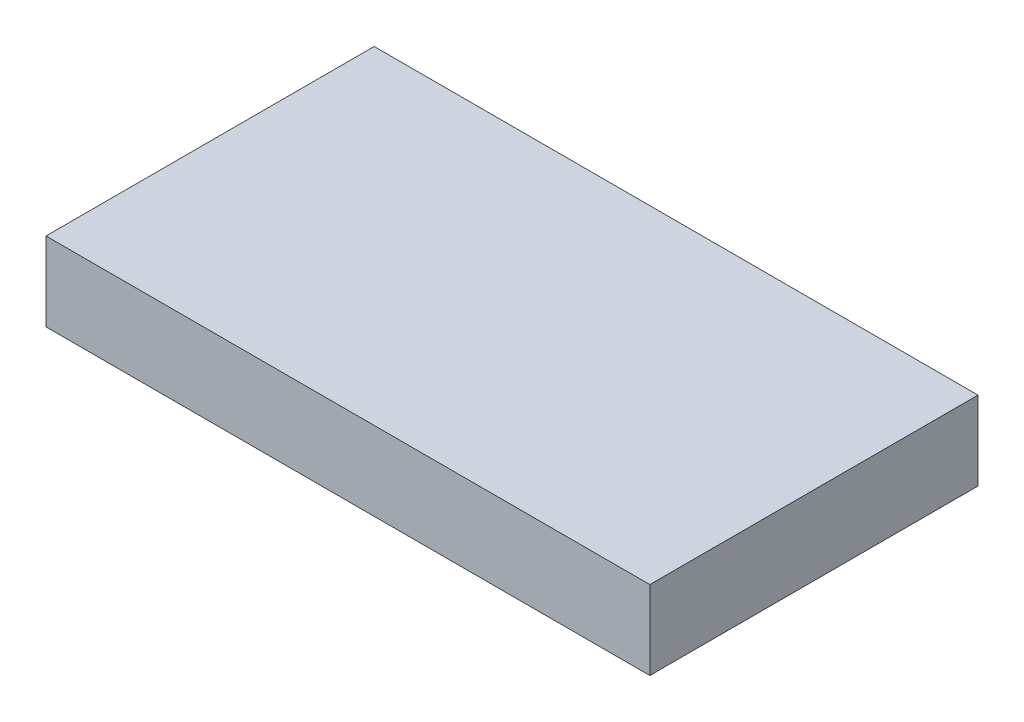
from build123d import *

# Parameters (mm, degrees)
SKETCH1_W           = 12.5
SKETCH1_H           = 3
BOSS_EXTRUDE1_DEPTH = 23


with BuildPart() as part:
    # Sketch1 → Boss-Extrude1 (new body)
    with BuildSketch(Plane(origin=(0, 0, 0), x_dir=(0, 0, -1), z_dir=(1, 0, 0))):
        Rectangle(SKETCH1_W, SKETCH1_H)
    extrude(amount=-BOSS_EXTRUDE1_DEPTH)


solid = part.part
